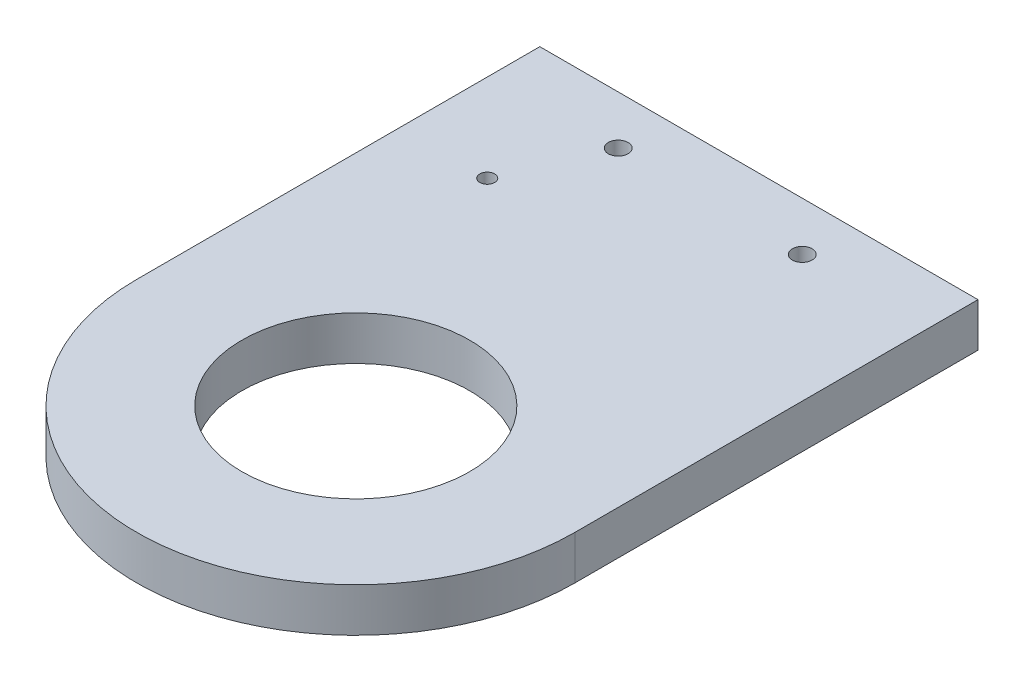
from build123d import *

# Parameters (mm, degrees)
PARED_START               = 29.75
SK_PARED_W                = 100
SK_PARED_H                = 92
PARED_DEPTH               = 10
CABEZA_START              = 29.75
SK_CABEZA_R               = 50
CABEZA_DEPTH              = 10
PASO_CUBO_J2_START        = 29.75
SK_PASO_CUBO_J2_R         = 26
PASO_CUBO_J2_DEPTH        = 10
PASANTES_M4_ANGULOS_START = 29.75
SK_PASANTES_M4_ANGULOS_R  = 2.25
PASANTES_M4_ANGULOS_DEPTH = 10
PASANTE_M3_CINCHO_START   = 29.75
SK_PASANTE_M3_CINCHO_R    = 1.7
PASANTE_M3_CINCHO_DEPTH   = 10


with BuildPart() as part:
    # Sk_Pared → Pared (new body)
    with BuildSketch(Plane(origin=(0, 0, 0), x_dir=(1, 0, 0), z_dir=(0, 1, 0)).offset(PARED_START)):
        with Locations((0, -124)):
            Rectangle(SK_PARED_W, SK_PARED_H)
    extrude(amount=PARED_DEPTH)

    # Sk_Cabeza → Cabeza (add)
    with BuildSketch(Plane(origin=(0, 0, 0), x_dir=(1, 0, 0), z_dir=(0, 1, 0)).offset(CABEZA_START)):
        with Locations((0, -170)):
            Circle(SK_CABEZA_R)
    extrude(amount=CABEZA_DEPTH)

    # Sk_Paso_cubo_J2 → Paso_cubo_J2 (cut)
    with BuildSketch(Plane(origin=(0, 0, 0), x_dir=(1, 0, 0), z_dir=(0, 1, 0)).offset(PASO_CUBO_J2_START)):
        with Locations(Location((0, -170, 0), (0, 0, 270))):
            Circle(SK_PASO_CUBO_J2_R)
    extrude(amount=PASO_CUBO_J2_DEPTH, mode=Mode.SUBTRACT)

    # Sk_Pasantes_M4_angulos → Pasantes_M4_angulos (cut)
    with BuildSketch(Plane(origin=(0, 0, 0), x_dir=(1, 0, 0), z_dir=(0, 1, 0)).offset(PASANTES_M4_ANGULOS_START)):
        with Locations(Location((-21, -89.11, 0), (0, 0, 270))):
            Circle(SK_PASANTES_M4_ANGULOS_R)
        with Locations(Location((21, -89.11, 0), (0, 0, 270))):
            Circle(SK_PASANTES_M4_ANGULOS_R)
    extrude(amount=PASANTES_M4_ANGULOS_DEPTH, mode=Mode.SUBTRACT)

    # Sk_Pasante_M3_cincho → Pasante_M3_cincho (cut)
    with BuildSketch(Plane(origin=(0, 0, 0), x_dir=(1, 0, 0), z_dir=(0, 1, 0)).offset(PASANTE_M3_CINCHO_START)):
        with Locations(Location((-30, -110, 0), (0, 0, 270))):
            Circle(SK_PASANTE_M3_CINCHO_R)
    extrude(amount=PASANTE_M3_CINCHO_DEPTH, mode=Mode.SUBTRACT)


solid = part.part
